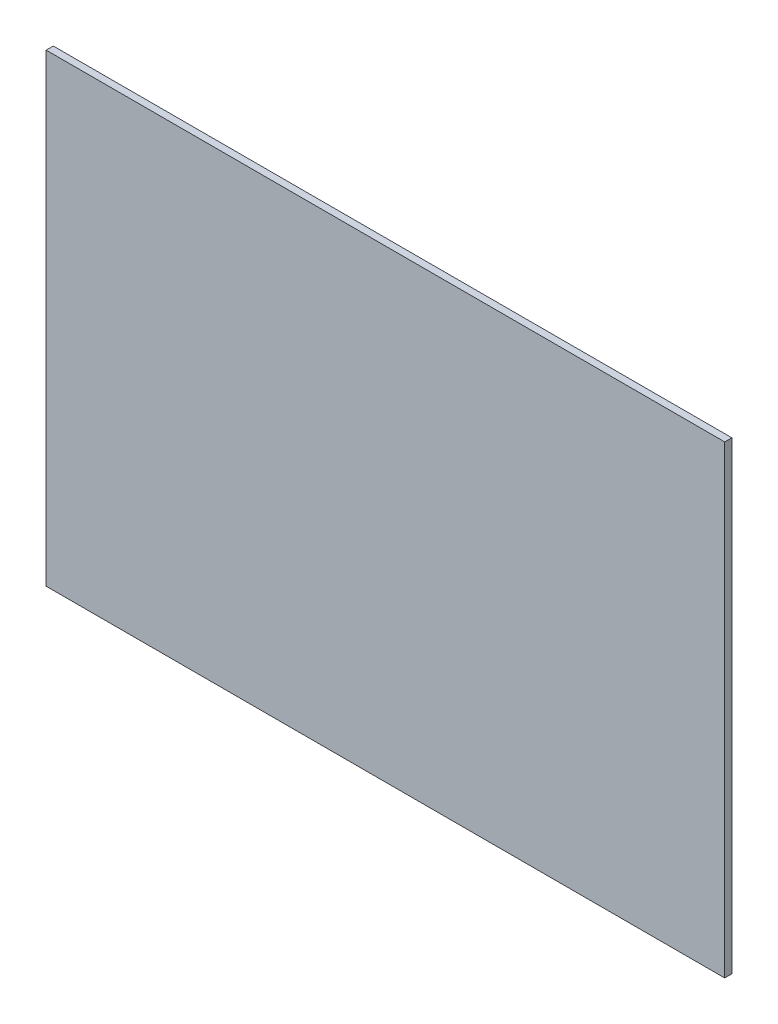
from build123d import *

# Parameters (mm, degrees)
ESQUISSE1_W        = 95
ESQUISSE1_H        = 65
BOSS_EXTRU_1_DEPTH = 1


with BuildPart() as part:
    # Esquisse1 → Boss.-Extru.1 (new body)
    with BuildSketch(Plane.XY):
        Rectangle(ESQUISSE1_W, ESQUISSE1_H)
    extrude(amount=BOSS_EXTRU_1_DEPTH)


solid = part.part
